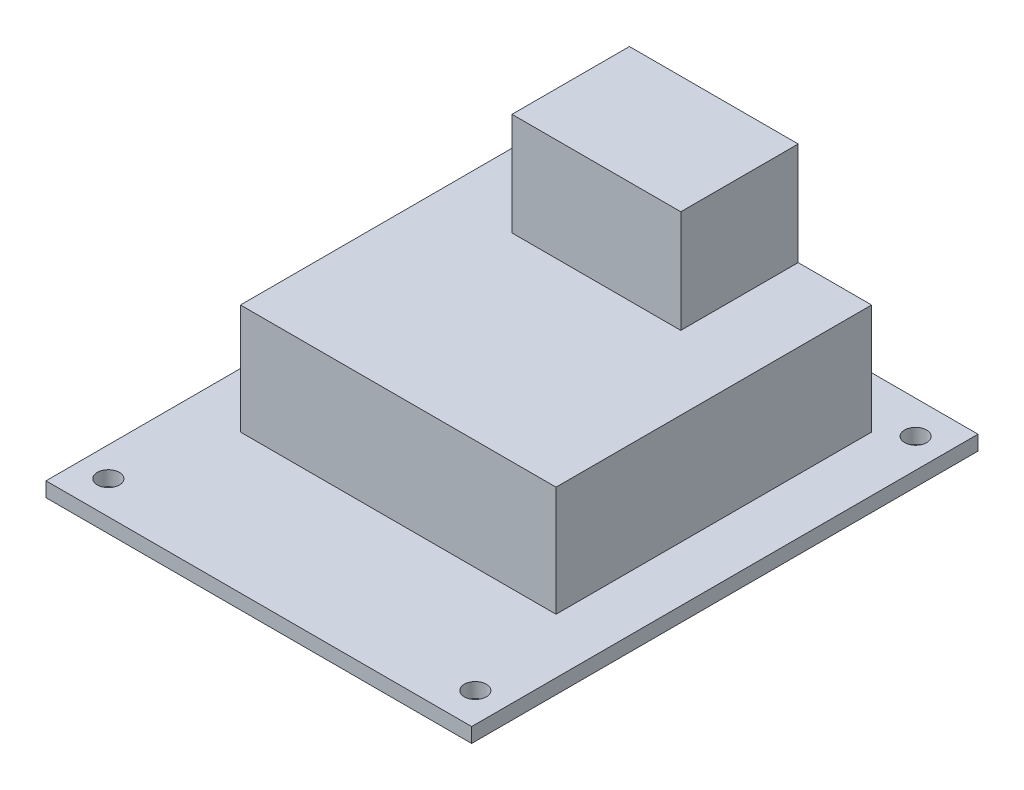
from build123d import *

# Parameters (mm, degrees)
SKETCH_1_W                  = 58
SKETCH_1_H                  = 69
EXTRUDE_351_DEPTH           = 2
SKETCH_2_W                  = 43
SKETCH_2_H                  = 43
EXTRUDE_607_DEPTH           = 15
SKETCH_3_W                  = 23
SKETCH_3_H                  = 16
EXTRUDE_850_DEPTH           = 14
SKETCH_4_W                  = 40
SKETCH_4_H                  = 50
EXTRUDE_1071_DEPTH          = 3
CUT_EXTRUDE_1381_DEPTH      = 54.593376456
CUT_EXTRUDE_1381_DEPTH_BACK = 54.593376456
SKETCH_7_R                  = 1.5


with BuildPart() as part:
    # Эскиз1 → Extrude 351 (new body)
    with BuildSketch(Plane.XZ):
        Rectangle(SKETCH_1_W, SKETCH_1_H)
    extrude(amount=-EXTRUDE_351_DEPTH)

    # Эскиз2 → Extrude 607 (add)
    with BuildSketch(Plane(origin=(0, 2, 0), x_dir=(-1, 0, 0), z_dir=(0, 1, 0))):
        with Locations((0, -6)):
            Rectangle(SKETCH_2_W, SKETCH_2_H)
    extrude(amount=EXTRUDE_607_DEPTH)

    # Эскиз3 → Extrude 850 (add)
    with BuildSketch(Plane(origin=(0, 17, 0), x_dir=(-1, 0, 0), z_dir=(0, 1, 0))):
        with Locations((0, -19.5)):
            Rectangle(SKETCH_3_W, SKETCH_3_H)
    extrude(amount=EXTRUDE_850_DEPTH)

    # Эскиз4 → Extrude 1071 (add)
    with BuildSketch(Plane.XZ):
        Rectangle(SKETCH_4_W, SKETCH_4_H)
    extrude(amount=EXTRUDE_1071_DEPTH)

    # Эскиз7 → Cut-Extrude 1381 (cut, two sides: drawn at the far end of the back side and taken through both)
    with BuildSketch(Plane(origin=(0, 2, 0), x_dir=(1, 0, 0), z_dir=(0, 1, 0)).offset(-CUT_EXTRUDE_1381_DEPTH_BACK)):
        with Locations(Location((-25, 30, 0), (0, 0, 90))):
            Circle(SKETCH_7_R)
        with Locations(Location((25, 30, 0), (0, 0, 90))):
            Circle(SKETCH_7_R)
        with Locations(Location((25, -30, 0), (0, 0, 90))):
            Circle(SKETCH_7_R)
        with Locations(Location((-25, -30, 0), (0, 0, 90))):
            Circle(SKETCH_7_R)
    extrude(amount=CUT_EXTRUDE_1381_DEPTH + CUT_EXTRUDE_1381_DEPTH_BACK, mode=Mode.SUBTRACT)


solid = part.part
